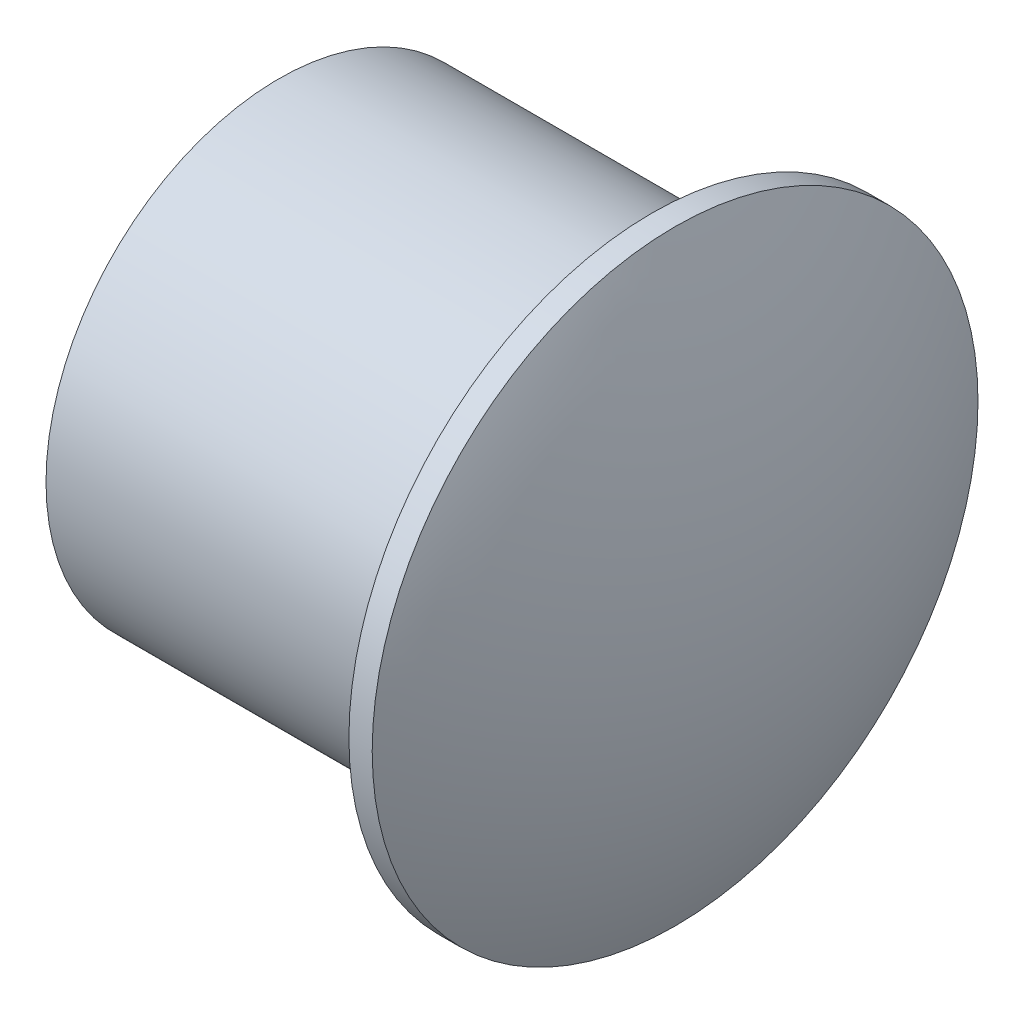
from build123d import *


with BuildPart() as part:
    # Sketch1 → Revolve1 (revolve)
    with BuildSketch(Plane.XY, mode=Mode.PRIVATE) as revolve1_sk:
        with BuildLine():
            Line((0, 0), (0, 10))
            Line((0, 10), (16, 10))
            Line((16, 10), (16, 13))
            Line((16, 13), (17, 13))
            ThreePointArc((17, 13), (19.240272139, 6.670832032), (20, 0))
            Line((20, 0), (0, 0))
        make_face()
    revolve(revolve1_sk.sketch.rotate(Axis((0, 0, 0), (1, 0, 0)), 90), axis=Axis((0, 0, 0), (1, 0, 0)))


solid = part.part
